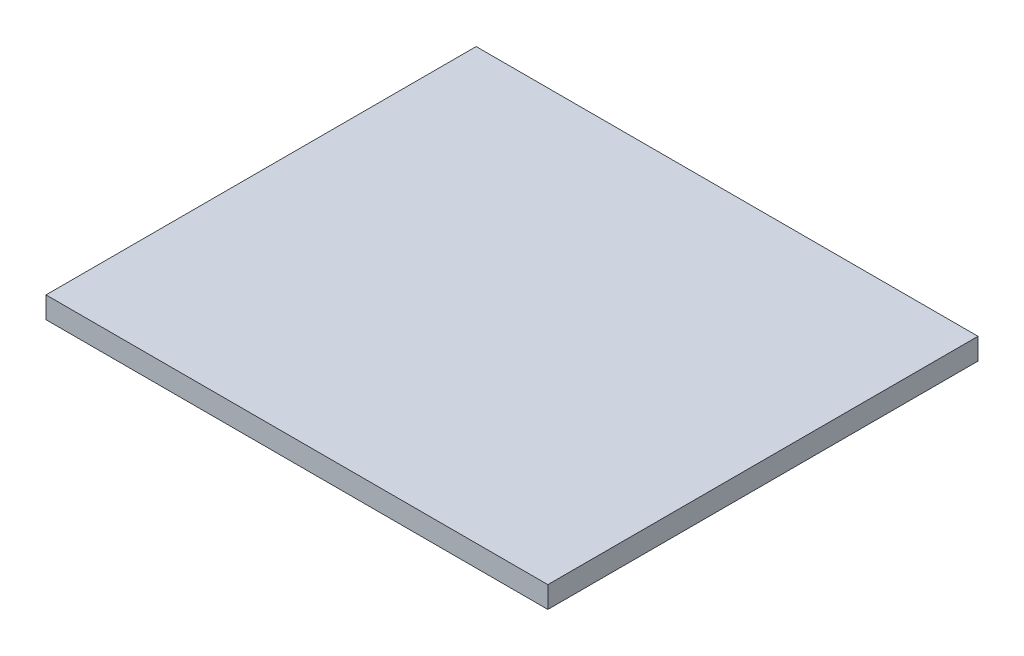
from build123d import *

# Parameters (mm, degrees)
ESQUISSE1_W        = 70
ESQUISSE1_H        = 60
BOSS_EXTRU_1_DEPTH = 3


with BuildPart() as part:
    # Esquisse1 → Boss.-Extru.1 (new body)
    with BuildSketch(Plane(origin=(0, 0, 0), x_dir=(1, 0, 0), z_dir=(0, 1, 0))):
        Rectangle(ESQUISSE1_W, ESQUISSE1_H)
    extrude(amount=BOSS_EXTRU_1_DEPTH)


solid = part.part
